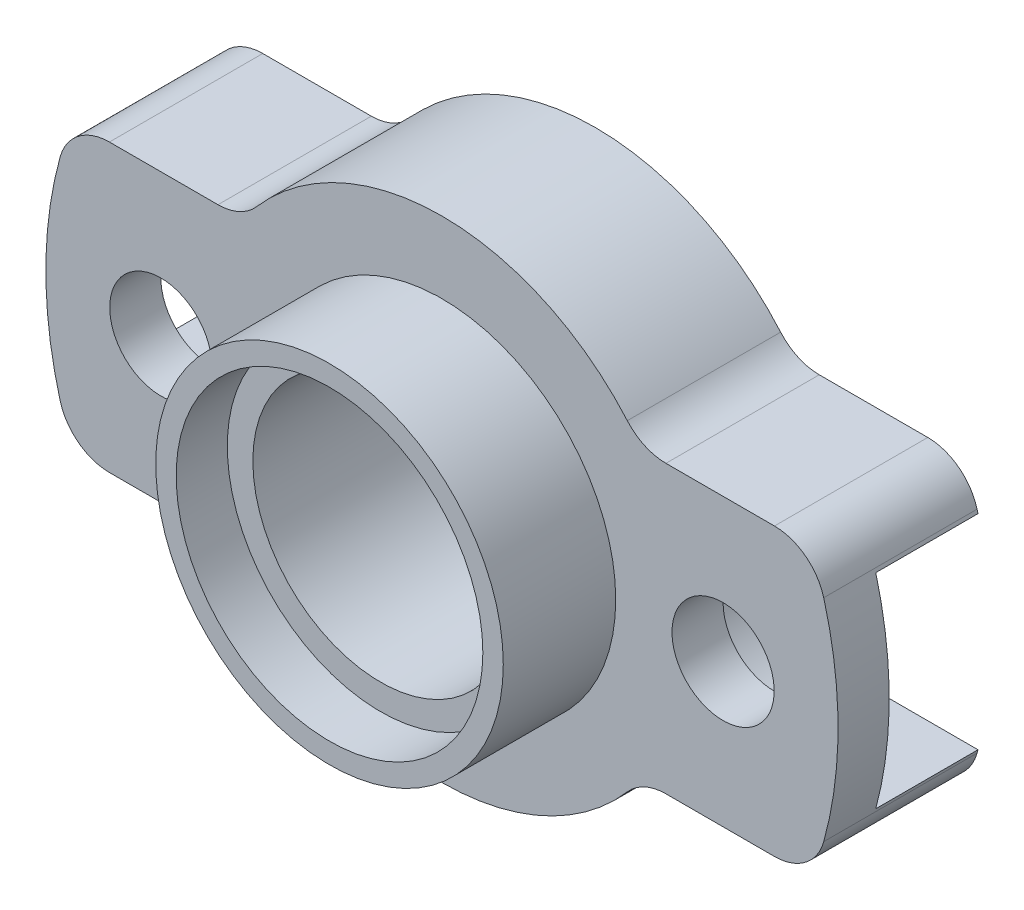
from build123d import *

# Parameters (mm, degrees)
SKETCH_1_R          = 2.5
SKETCH_1_R_2        = 1
EXTRUDE_1_DEPTH     = 3
SKETCH_2_R          = 3.4
SKETCH_2_R_2        = 2.5
EXTRUDE_2_DEPTH     = 2.2
CUT_EXTRUDE_1_DEPTH = 2
SKETCH_5_R          = 3
CUT_EXTRUDE_2_DEPTH = 1


with BuildPart() as part:
    # 草图1 → 凸台-拉伸1 (new body)
    with BuildSketch(Plane.XY):
        with BuildLine():
            Line((-6.505574533, 2.8), (-4.38178046, 2.8))
            ThreePointArc((-4.38178046, 2.8), (-3.966553061, 2.890282348), (-3.62630107, 3.144827586))
            ThreePointArc((-3.62630107, 3.144827586), (0, 4.8), (3.62630107, 3.144827586))
            ThreePointArc((3.62630107, 3.144827586), (3.966553061, 2.890282348), (4.38178046, 2.8))
            Line((4.38178046, 2.8), (6.505574533, 2.8))
            ThreePointArc((6.505574533, 2.8), (7.111104603, 2.595822426), (7.469363352, 2.066666667))
            ThreePointArc((7.469363352, 2.066666667), (7.75, 0), (7.469363352, -2.066666667))
            ThreePointArc((7.469363352, -2.066666667), (7.111104603, -2.595822426), (6.505574533, -2.8))
            Line((6.505574533, -2.8), (4.38178046, -2.8))
            ThreePointArc((4.38178046, -2.8), (3.966553061, -2.890282348), (3.62630107, -3.144827586))
            ThreePointArc((3.62630107, -3.144827586), (0, -4.8), (-3.62630107, -3.144827586))
            ThreePointArc((-3.62630107, -3.144827586), (-3.966553061, -2.890282348), (-4.38178046, -2.8))
            Line((-4.38178046, -2.8), (-6.505574533, -2.8))
            ThreePointArc((-6.505574533, -2.8), (-7.111104603, -2.595822426), (-7.469363352, -2.066666667))
            ThreePointArc((-7.469363352, -2.066666667), (-7.75, 0), (-7.469363352, 2.066666667))
            ThreePointArc((-7.469363352, 2.066666667), (-7.111104603, 2.595822426), (-6.505574533, 2.8))
        make_face()
        Circle(SKETCH_1_R, mode=Mode.SUBTRACT)
        with Locations((-5.5, 0)):
            Circle(SKETCH_1_R_2, mode=Mode.SUBTRACT)
        with Locations(Location((5.5, 0, 0), (0, 0, 180))):
            Circle(SKETCH_1_R_2, mode=Mode.SUBTRACT)
    extrude(amount=EXTRUDE_1_DEPTH)

    # 草图2 → 凸台-拉伸2 (add)
    with BuildSketch(Plane.XY.offset(3)):
        Circle(SKETCH_2_R)
        Circle(SKETCH_2_R_2, mode=Mode.SUBTRACT)
    extrude(amount=EXTRUDE_2_DEPTH)

    # 草图4 → 切除-拉伸1 (cut)
    with BuildSketch(Plane(origin=(0, 0, 0), x_dir=(-1, 0, 0), z_dir=(0, 0, -1))):
        with BuildLine():
            Line((-5.5, 2), (-7.487489566, 2))
            ThreePointArc((-7.487489566, 2), (-7.75, 0), (-7.487489566, -2))
            Line((-7.487489566, -2), (-5.5, -2))
            ThreePointArc((-5.5, -2), (-3.5, 0), (-5.5, 2))
        make_face()
        with BuildLine():
            Line((5.5, -2), (7.487489566, -2))
            ThreePointArc((7.487489566, -2), (7.75, 0), (7.487489566, 2))
            Line((7.487489566, 2), (5.5, 2))
            ThreePointArc((5.5, 2), (3.5, 0), (5.5, -2))
        make_face()
    extrude(amount=-CUT_EXTRUDE_1_DEPTH, mode=Mode.SUBTRACT)

    # 草图5 → 切除-拉伸2 (cut)
    with BuildSketch(Plane.XY.offset(5.2)):
        Circle(SKETCH_5_R)
    extrude(amount=-CUT_EXTRUDE_2_DEPTH, mode=Mode.SUBTRACT)


solid = part.part
